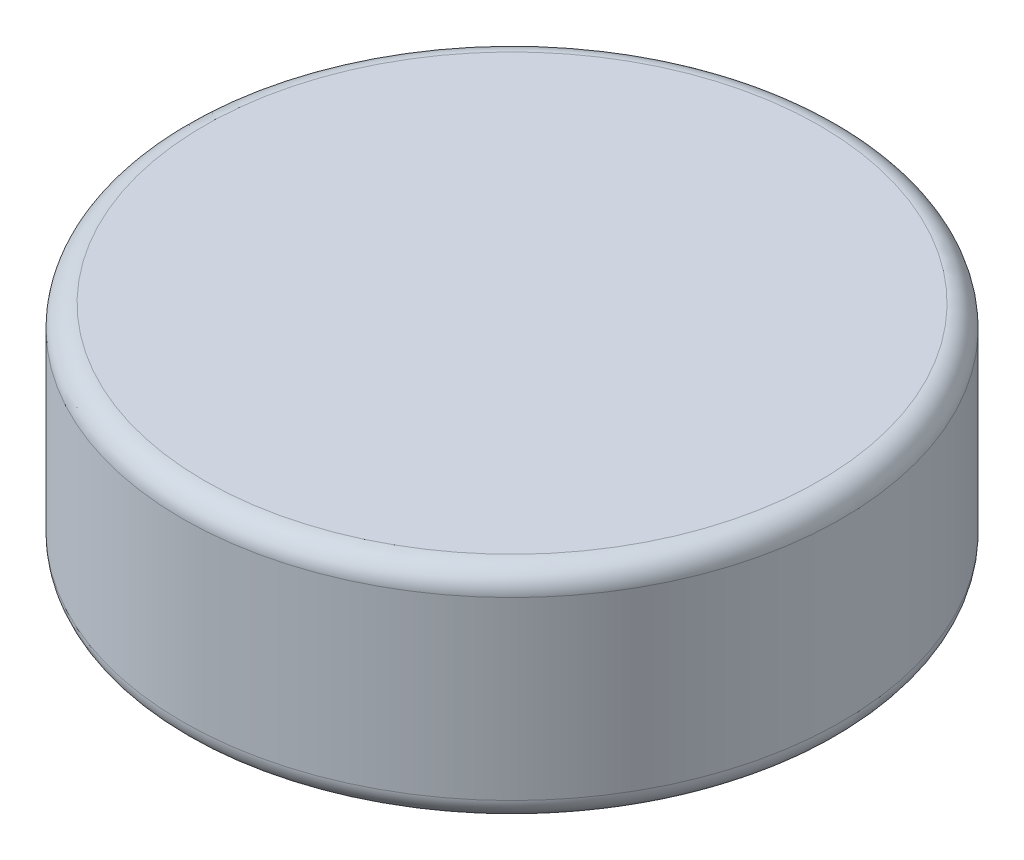
from build123d import *

# Parameters (mm, degrees)
SKETCH1_R           = 1.5
BOSS_EXTRUDE1_DEPTH = 1
FILLET1_R           = 0.1


with BuildPart() as part:
    # Sketch1 → Boss-Extrude1 (new body)
    with BuildSketch(Plane(origin=(0, 0, 0), x_dir=(1, 0, 0), z_dir=(0, 1, 0))):
        with Locations(Location((0, 0, 0), (0, 0, 270))):
            Circle(SKETCH1_R)
    extrude(amount=BOSS_EXTRUDE1_DEPTH)

    # Fillet1
    fillet1_edges = [part.edges().sort_by_distance(p)[0] for p in [
        (0, 0, -1.5),
        (0, 1, -1.5),
    ]]
    fillet(fillet1_edges, radius=FILLET1_R)


solid = part.part
